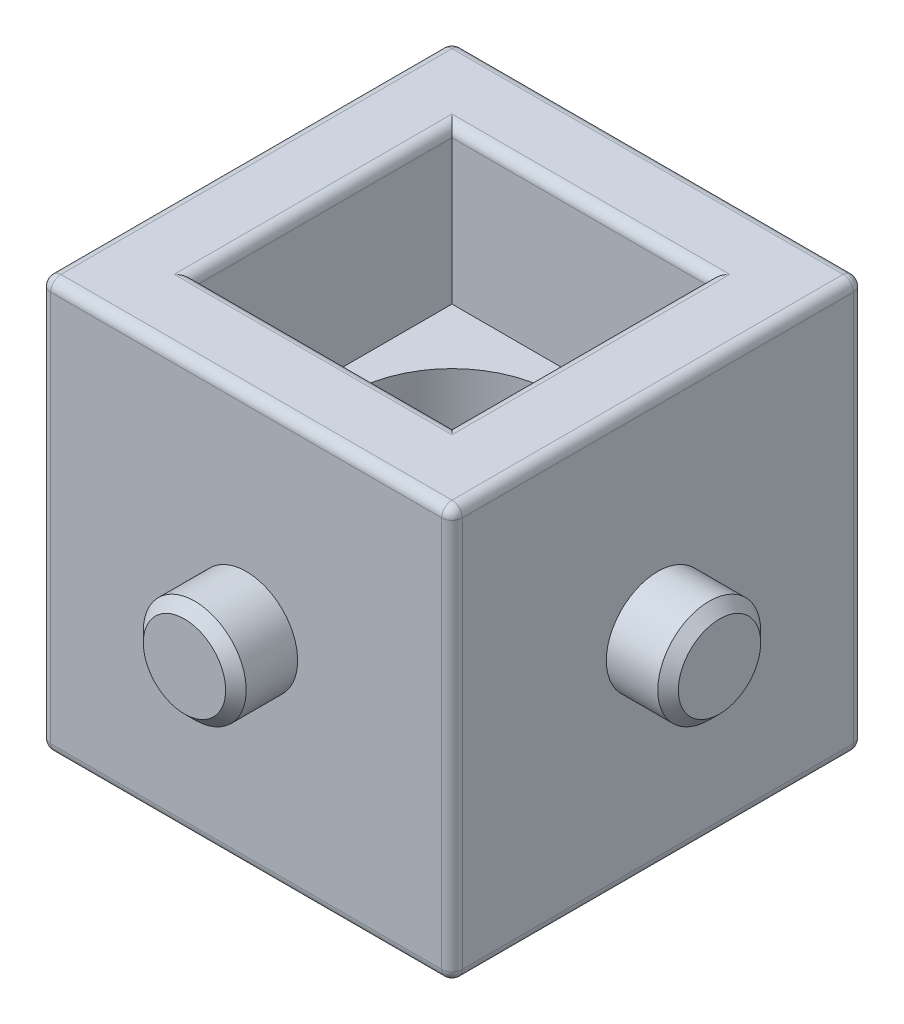
from build123d import *

# Parameters (mm, degrees)
SKETCH_1_W          = 8
SKETCH_1_H          = 8
EXTRUDE_1_DEPTH     = 8
SKETCH_2_W          = 5
SKETCH_2_H          = 5
CUT_EXTRUDE_1_DEPTH = 3
SKETCH_3_W          = 5
SKETCH_3_H          = 5
CUT_EXTRUDE_2_DEPTH = 3
CUT_EXTRUDE_3_REACH = 9.55
SKETCH_4_R          = 2
SKETCH_5_R          = 1
EXTRUDE_2_DEPTH     = 1.2
SKETCH_6_R          = 1
EXTRUDE_3_DEPTH     = 1.2
CHAMFER_1_SIZE      = 0.2
FILLET_1_R          = 0.2


with BuildPart() as part:
    # 草图1 → 凸台-拉伸1 (new body)
    with BuildSketch(Plane(origin=(0, 0, 0), x_dir=(1, 0, 0), z_dir=(0, 1, 0))):
        Rectangle(SKETCH_1_W, SKETCH_1_H)
    extrude(amount=EXTRUDE_1_DEPTH)

    # 草图2 → 切除-拉伸1 (cut)
    with BuildSketch(Plane(origin=(0, 8, 0), x_dir=(1, 0, 0), z_dir=(0, 1, 0))):
        Rectangle(SKETCH_2_W, SKETCH_2_H)
    extrude(amount=-CUT_EXTRUDE_1_DEPTH, mode=Mode.SUBTRACT)

    # 草图3 → 切除-拉伸2 (cut)
    with BuildSketch(Plane.XZ):
        Rectangle(SKETCH_3_W, SKETCH_3_H)
    extrude(amount=-CUT_EXTRUDE_2_DEPTH, mode=Mode.SUBTRACT)

    # 草图4 → 切除-拉伸3 (cut, up to next)
    with BuildSketch(Plane.XZ.offset(-3), mode=Mode.PRIVATE) as cut_extrude_3_sk1:
        with Locations(Location((0, 0, 0), (0, 0, 270))):
            Circle(SKETCH_4_R)
    cut_extrude_3_tool1 = extrude(cut_extrude_3_sk1.sketch, amount=-CUT_EXTRUDE_3_REACH, mode=Mode.PRIVATE) & part.part
    add(cut_extrude_3_tool1.solids().sort_by_distance((0, 3, 0))[0], mode=Mode.SUBTRACT)

    # 草图5 → 凸台-拉伸2 (add)
    with BuildSketch(Plane.ZY.offset(4)):
        with Locations(Location((0, 4, 0), (0, 0, 180))):
            Circle(SKETCH_5_R)
    extrude_2 = extrude(amount=EXTRUDE_2_DEPTH)

    # 镜向1: 凸台-拉伸2 across plane
    add(extrude_2.mirror(Plane(origin=(0, 0, 0), x_dir=(0, 0, 1), z_dir=(1, 0, 0))))

    # 草图6 → 凸台-拉伸3 (add)
    with BuildSketch(Plane(origin=(0, 0, -4), x_dir=(-1, 0, 0), z_dir=(0, 0, -1))):
        with Locations(Location((0, 4, 0), (0, 0, 180))):
            Circle(SKETCH_6_R)
    extrude_3 = extrude(amount=EXTRUDE_3_DEPTH)

    # 镜向2: 凸台-拉伸3 across plane
    add(extrude_3.mirror(Plane.XY))

    # 倒角1
    chamfer_1_edges = [part.edges().sort_by_distance(p)[0] for p in [
        (-5.2, 4, 1),
        (5.2, 4, 1),
        (-1, 4, -5.2),
        (-1, 4, 5.2),
    ]]
    chamfer(chamfer_1_edges, length=CHAMFER_1_SIZE)

    # 圆角1
    fillet_1_edges = [part.edges().sort_by_distance(p)[0] for p in [
        (0, 8, 4),
        (4, 8, 0),
        (2.5, 8, 0),
        (0, 8, -2.5),
        (-2.5, 8, 0),
        (0, 8, 2.5),
        (-2.5, 0, 0),
        (0, 0, -2.5),
        (2.5, 0, 0),
        (0, 0, 2.5),
        (0, 8, -4),
        (4, 0, 0),
        (0, 0, 4),
        (-4, 0, 0),
        (0, 0, -4),
        (-4, 8, 0),
        (4, 4, -4),
        (4, 4, 4),
        (-4, 4, 4),
        (-4, 4, -4),
    ]]
    fillet(fillet_1_edges, radius=FILLET_1_R)


solid = part.part
